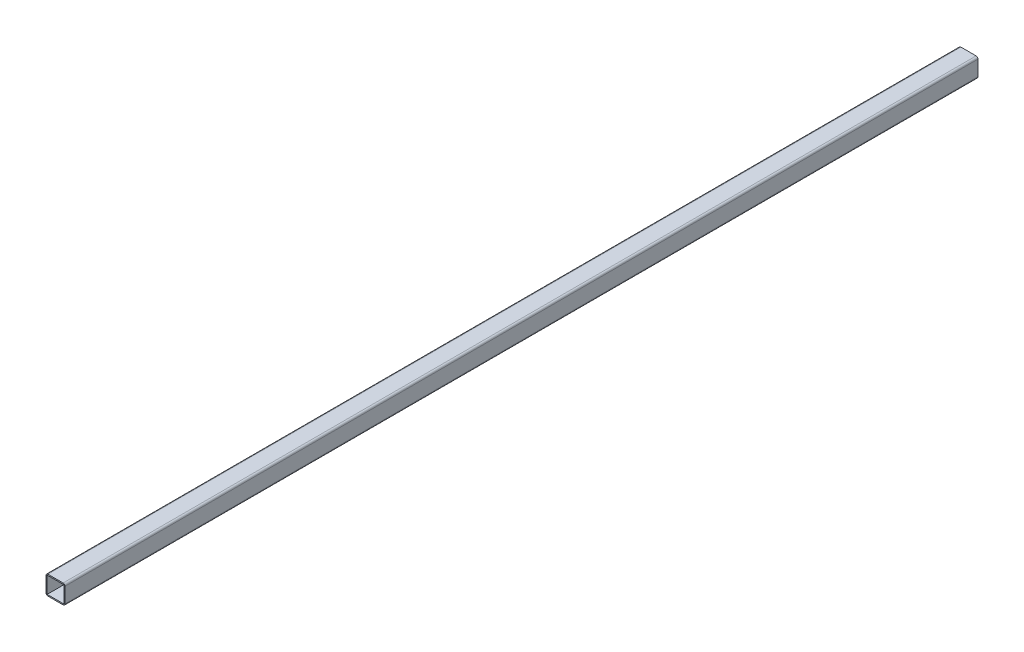
from build123d import *

# Parameters (mm, degrees)
SKETCH1_W           = 50.8
SKETCH1_H           = 50.8
SKETCH1_W_2         = 44.45
SKETCH1_H_2         = 44.45
BOSS_EXTRUDE1_DEPTH = 2438.4
FILLET1_R           = 5


with BuildPart() as part:
    # Sketch1 → Boss-Extrude1 (new body)
    with BuildSketch(Plane.XY):
        Rectangle(SKETCH1_W, SKETCH1_H)
        Rectangle(SKETCH1_W_2, SKETCH1_H_2, mode=Mode.SUBTRACT)
    extrude(amount=BOSS_EXTRUDE1_DEPTH)

    # Fillet1
    fillet1_edges = [part.edges().sort_by_distance(p)[0] for p in [
        (25.4, -25.4, 1219.2),
        (-25.4, -25.4, 1219.2),
        (-25.4, 25.4, 1219.2),
        (25.4, 25.4, 1219.2),
    ]]
    fillet(fillet1_edges, radius=FILLET1_R)


solid = part.part
